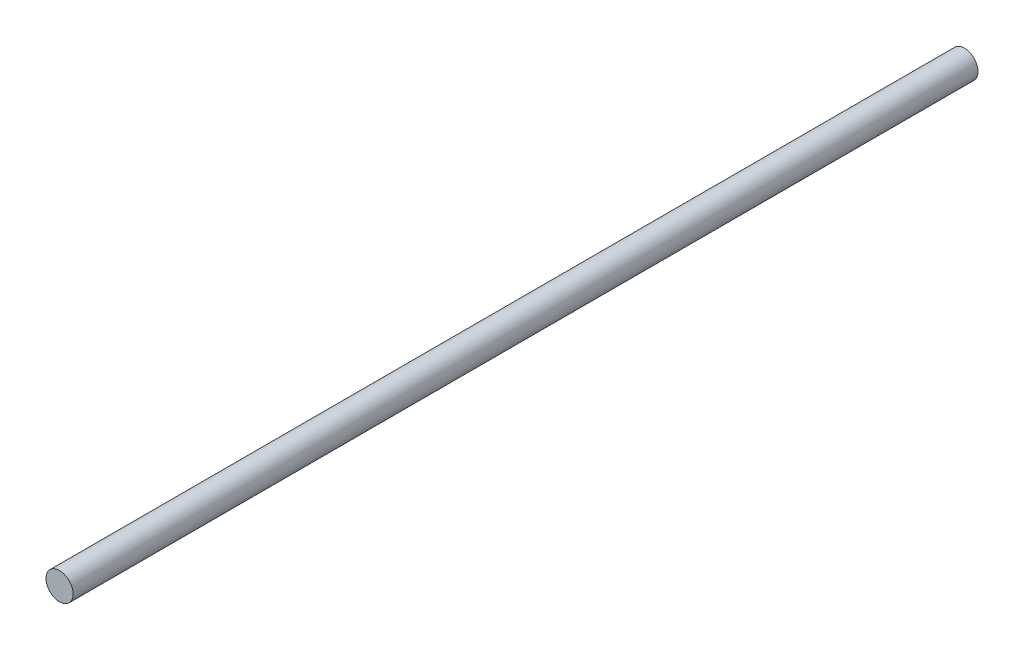
from build123d import *

# Parameters (mm, degrees)
SKETCH1_R           = 3.75
BOSS_EXTRUDE1_DEPTH = 250


with BuildPart() as part:
    # Sketch1 → Boss-Extrude1 (new body)
    with BuildSketch(Plane.XY):
        with Locations((-174.485961105, 88.996660734)):
            Circle(SKETCH1_R)
    extrude(amount=BOSS_EXTRUDE1_DEPTH)


solid = part.part
